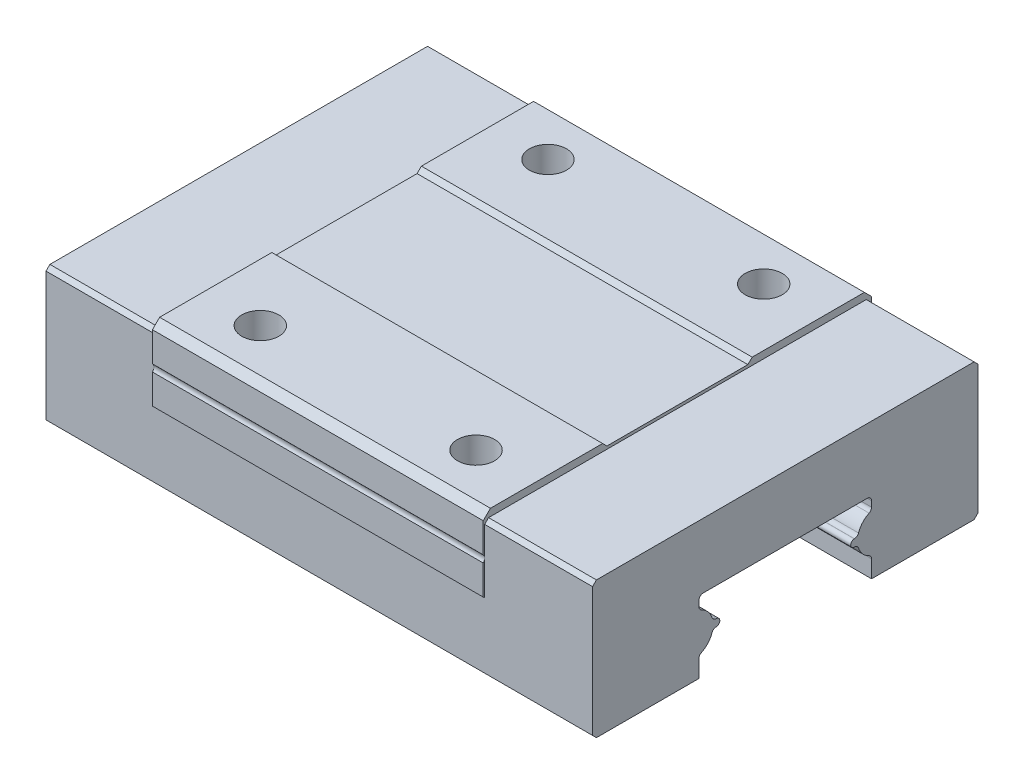
from build123d import *

# Parameters (mm, degrees)
EXTRUDE_1_DEPTH        = 38
SKETCH_2_W             = 23
SKETCH_2_H             = 4.7
EXTRUDE_2_DEPTH        = 0.1
SKETCH_3_W             = 23
SKETCH_3_H             = 4.6
EXTRUDE_3_DEPTH        = 0.1
SKETCH_4_W             = 23
SKETCH_4_H             = 27
EXTRUDE_4_DEPTH        = 0.5
CUT_EXTRUDE_1_DEPTH    = 23
SKETCH_6_W             = 9.8
SKETCH_6_H             = 0.3
CUT_EXTRUDE_2_DEPTH    = 35.54706934
DRAFT_1_ANGLE          = 45
DRAFT_2_ANGLE          = 45
DRAFT_3_ANGLE          = 45
HOLE_WIZARD_M2_1_D     = 2.58
HOLE_WIZARD_M2_1_DEPTH = 3.5
HOLE_WIZARD_M2_1_TIP   = 0.775110199
CHAMFER_1_SIZE         = 0.27
CHAMFER_2_SIZE         = 0.5
FILLET_1_R             = 0.3


with BuildPart() as part:
    # 草图1 → 凸台-拉伸1 (new body)
    with BuildSketch(Plane(origin=(-19, 0, 0), x_dir=(0, -1, 0), z_dir=(-1, 0, 0))):
        with BuildLine():
            Line((1, 13.4), (-8.5, 13.4))
            Line((-8.5, 13.4), (-8.5, -13.4))
            Line((-8.5, -13.4), (1, -13.4))
            Line((1, -13.4), (1, -6))
            Line((1, -6), (-0.408889, -6))
            ThreePointArc((-0.408889, -6), (-0.826571316, -5.367595703), (-1.51, -5.04))
            Line((-1.51, -5.04), (-1.51, -4.8))
            ThreePointArc((-1.51, -4.8), (-1.76, -4.55), (-2.01, -4.8))
            Line((-2.01, -4.8), (-2.01, -5.04))
            ThreePointArc((-2.01, -5.04), (-2.693428684, -5.367595703), (-3.111111, -6))
            Line((-3.111111, -6), (-4, -6))
            Line((-4, -6), (-4, 6))
            Line((-4, 6), (-3.111111, 6))
            ThreePointArc((-3.111111, 6), (-2.693428684, 5.367595703), (-2.01, 5.04))
            Line((-2.01, 5.04), (-2.01, 4.8))
            ThreePointArc((-2.01, 4.8), (-1.76, 4.55), (-1.51, 4.8))
            Line((-1.51, 4.8), (-1.51, 5.04))
            ThreePointArc((-1.51, 5.04), (-0.826571316, 5.367595703), (-0.408889, 6))
            Line((-0.408889, 6), (1, 6))
            Line((1, 6), (1, 13.4))
        make_face()
    extrude(amount=-EXTRUDE_1_DEPTH)

    # 草图2 → 凸台-拉伸2 (add)
    with BuildSketch(Plane(origin=(0, 0, -13.4), x_dir=(-1, 0, 0), z_dir=(0, 0, -1))):
        with Locations((0, 6.15)):
            Rectangle(SKETCH_2_W, SKETCH_2_H)
    extrude(amount=EXTRUDE_2_DEPTH)

    # 草图3 → 凸台-拉伸3 (add)
    with BuildSketch(Plane.XY.offset(13.4)):
        with Locations((0, 6.2)):
            Rectangle(SKETCH_3_W, SKETCH_3_H)
    extrude(amount=EXTRUDE_3_DEPTH)

    # 草图4 → 凸台-拉伸4 (add)
    with BuildSketch(Plane(origin=(0, 8.5, 0), x_dir=(-1, 0, 0), z_dir=(0, 1, 0))):
        Rectangle(SKETCH_4_W, SKETCH_4_H)
    extrude(amount=EXTRUDE_4_DEPTH)

    # 草图5 → 切除-拉伸1 (cut)
    with BuildSketch(Plane(origin=(11.5, 0, 0), x_dir=(0, 0, -1), z_dir=(1, 0, 0))):
        with BuildLine():
            Line((-13.5, 6.444948974), (-13.5, 5.955051026))
            ThreePointArc((-13.5, 5.955051026), (-13.4, 6.2), (-13.5, 6.444948974))
        make_face()
    extrude(amount=-CUT_EXTRUDE_1_DEPTH, mode=Mode.SUBTRACT)

    # 草图6 → 切除-拉伸2 (cut, through all)
    with BuildSketch(Plane(origin=(11.5, 0, 0), x_dir=(0, 0, -1), z_dir=(1, 0, 0))):
        with Locations((0, 8.85)):
            Rectangle(SKETCH_6_W, SKETCH_6_H)
    extrude(amount=-CUT_EXTRUDE_2_DEPTH, mode=Mode.SUBTRACT)

    # 拔模1
    draft_1_faces = [part.faces().sort_by_distance(p)[0] for p in [
        (0, 3.9, 13.45),
    ]]
    draft(draft_1_faces, Plane.XY.offset(13.5), DRAFT_1_ANGLE)

    # 拔模2
    draft_2_faces = [part.faces().sort_by_distance(p)[0] for p in [
        (0, 3.8, -13.45),
    ]]
    draft(draft_2_faces, Plane(origin=(19, 8.5, -13.4), x_dir=(0, -1, 0), z_dir=(0, 0, -1)), DRAFT_2_ANGLE)

    # 拔模3
    draft_3_faces = [part.faces().sort_by_distance(p)[0] for p in [
        (0, 8.85, 4.9),
        (0, 8.85, -4.9),
    ]]
    draft(draft_3_faces, Plane(origin=(-19, 8.7, 4.9), x_dir=(0, 0, 1), z_dir=(0, 1, 0)), DRAFT_3_ANGLE)

    # M2 间隙孔1
    with Locations(Plane(origin=(0, 9, 0), x_dir=(1, 0, 0), z_dir=(0, 1, 0))):
        with Locations((7.5, -10), (-7.5, -10), (-7.5, 10), (7.5, 10)):
            Hole(HOLE_WIZARD_M2_1_D / 2, depth=HOLE_WIZARD_M2_1_DEPTH)
            with Locations((0, 0, -(HOLE_WIZARD_M2_1_DEPTH + HOLE_WIZARD_M2_1_TIP / 2))):  # 118° drill point
                Cone(0, HOLE_WIZARD_M2_1_D / 2, HOLE_WIZARD_M2_1_TIP, mode=Mode.SUBTRACT)

    # 倒角1
    chamfer_1_edges = [part.edges().sort_by_distance(p)[0] for p in [
        (0, -1, -13.4),
        (15.25, 8.5, -13.4),
        (15.25, 8.5, 13.4),
        (0, -1, 13.4),
        (-15.25, 8.5, -13.4),
        (-15.25, 8.5, 13.4),
    ]]
    chamfer(chamfer_1_edges, length=CHAMFER_1_SIZE)

    # 倒角2
    chamfer_2_edges = [part.edges().sort_by_distance(p)[0] for p in [
        (0, 9, 13.5),
        (0, 9, -13.5),
    ]]
    chamfer(chamfer_2_edges, length=CHAMFER_2_SIZE)

    # 圆角1
    fillet_1_edges = [part.edges().sort_by_distance(p)[0] for p in [
        (0, 0.408889, 6),
        (0, 1.51, 5.04),
        (0, 2.01, 5.04),
        (0, 3.111111, 6),
        (0, 4, 6),
        (0, 4, -6),
        (0, 3.111111, -6),
        (0, 2.01, -5.04),
        (0, 1.51, -5.04),
        (0, 0.408889, -6),
    ]]
    fillet(fillet_1_edges, radius=FILLET_1_R)


solid = part.part
